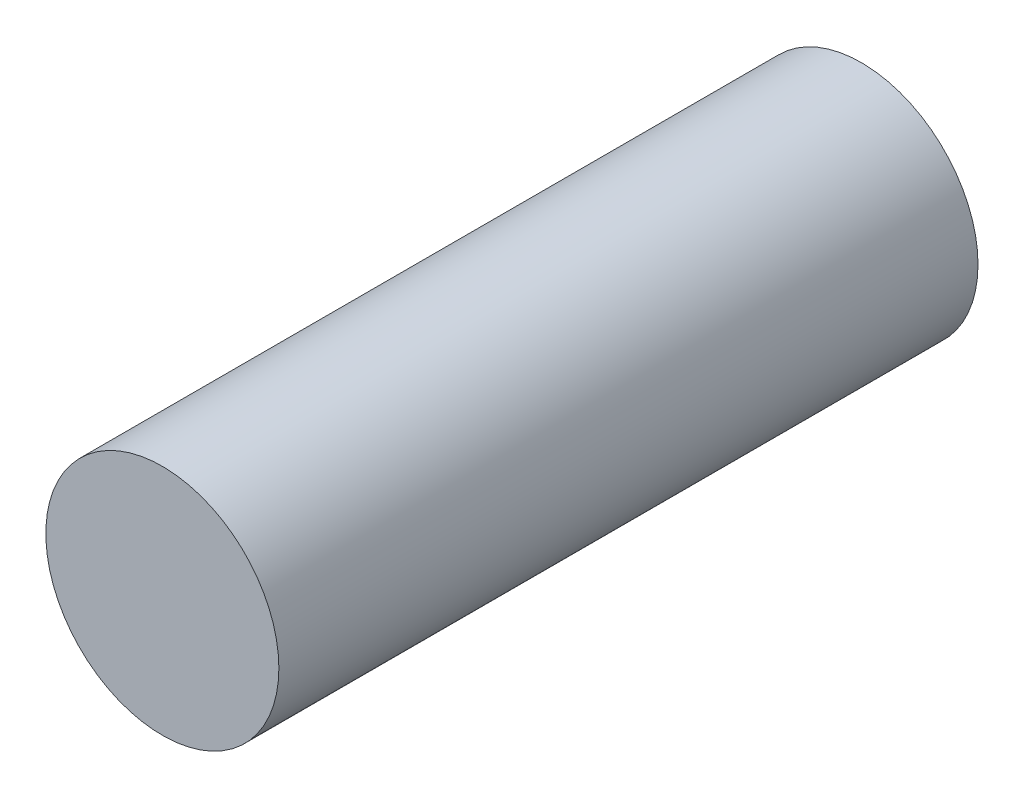
from build123d import *

# Parameters (mm, degrees)
SKETCH1_R           = 10
BOSS_EXTRUDE1_DEPTH = 60
SKETCH2_R           = 4
CUT_EXTRUDE1_DEPTH  = 10


with BuildPart() as part:
    # Sketch1 → Boss-Extrude1 (new body)
    with BuildSketch(Plane.XY):
        Circle(SKETCH1_R)
    extrude(amount=BOSS_EXTRUDE1_DEPTH)

    # Sketch2 → Cut-Extrude1 (cut)
    with BuildSketch(Plane(origin=(0, 0, 0), x_dir=(-1, 0, 0), z_dir=(0, 0, -1))):
        Circle(SKETCH2_R)
    extrude(amount=-CUT_EXTRUDE1_DEPTH, mode=Mode.SUBTRACT)


solid = part.part
